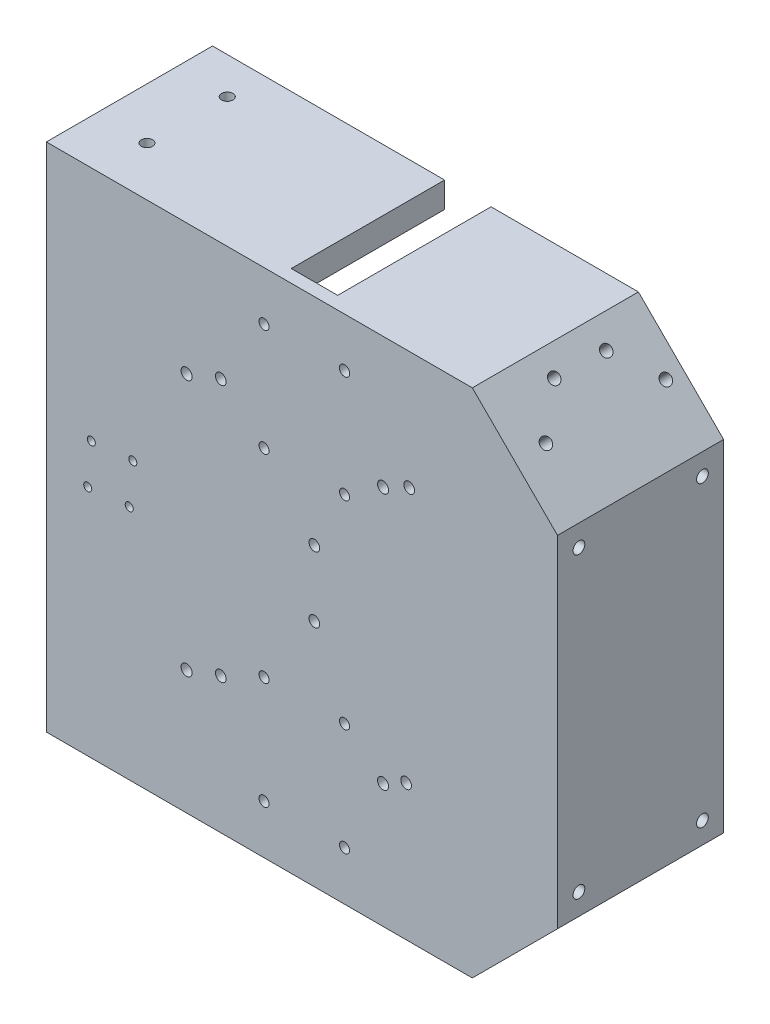
from build123d import *

# Parameters (mm, degrees)
BOSS_EXTRUDE1_DEPTH = 3.81
BOSS_EXTRUDE2_DEPTH = 45.72
SKETCH7_R           = 1.2
CUT_EXTRUDE2_DEPTH  = 17.78
SKETCH8_W           = 32.05672174
SKETCH8_H           = 17.78
SKETCH8_W_2         = 39.67672174
SKETCH8_H_2         = 25.4
BOSS_EXTRUDE3_DEPTH = 3.81
SKETCH9_R           = 1.65
CUT_EXTRUDE3_DEPTH  = 3.81
SKETCH10_R          = 1.547764227
SKETCH10_R_2        = 1.5
CUT_EXTRUDE4_DEPTH  = 7.62
CUT_EXTRUDE5_REACH  = 178.416
SKETCH11_R          = 1.7
SKETCH12_R          = 1.699999995
SKETCH12_R_2        = 1.691563864
CUT_EXTRUDE6_DEPTH  = 208.601302742
CUT_EXTRUDE7_REACH  = 208.774
SKETCH13_R          = 1.650000001
CUT_EXTRUDE8_REACH  = 208.774
SKETCH14_R          = 1.684585229
SKETCH14_R_2        = 1.65
SKETCH14_R_3        = 1.561252311
CUT_EXTRUDE9_REACH  = 163.375
SKETCH15_R          = 1.65
CUT_EXTRUDE10_REACH = 178.416
SKETCH16_R          = 1.75006
SKETCH16_R_2        = 1.750059992
CUT_EXTRUDE11_REACH = 162.247
SKETCH17_R          = 1.6
SKETCH17_R_2        = 1.599999975


with BuildPart() as part:
    # Sketch1 → Boss-Extrude1 (new body)
    with BuildSketch(Plane.XY):
        Polygon((133.35, -50.8), (107.95, -76.2), (-19.05, -76.2), (-19.05, 76.2), (107.95, 76.2), (133.35, 50.8), align=None)
    extrude(amount=BOSS_EXTRUDE1_DEPTH)

    # Sketch2 → Boss-Extrude2 (add)
    with BuildSketch(Plane(origin=(0, 0, 0), x_dir=(-1, 0, 0), z_dir=(0, 0, -1))):
        Polygon((-107.95, -76.2), (-133.35, -50.8), (-133.35, 50.8), (-107.95, 76.2), (-63.99665634, 76.2), (-63.99665634, 68.58), (-104.793692655, 68.58), (-125.73, 47.643692655), (-125.73, -47.643692655), (-104.793692655, -68.58), (-63.99665634, -68.58), (-63.99665634, -76.2), align=None)
        Polygon((19.05, 76.2), (19.05, 24.36400377), (11.43, 24.36400377), (11.43, 68.58), (-50.152826914, 68.58), (-50.152826914, 76.2), align=None)
        Polygon((19.05, -76.2), (-50.152826914, -76.2), (-50.152826914, -68.58), (11.43, -68.58), (11.43, -24.36400377), (19.05, -24.36400377), align=None)
    extrude(amount=BOSS_EXTRUDE2_DEPTH)

    # Sketch7 → Cut-Extrude2 (cut)
    with BuildSketch(Plane(origin=(0, 0, 0), x_dir=(-1, 0, 0), z_dir=(0, 0, -1))):
        with Locations((-6.717514421, 6.717514421)):
            Circle(SKETCH7_R)
        with Locations((5.65685425, 5.65685425)):
            Circle(SKETCH7_R)
        with Locations((-5.656854249, -5.656854249)):
            Circle(SKETCH7_R)
        with Locations((6.717514421, -6.717514421)):
            Circle(SKETCH7_R)
    extrude(amount=-CUT_EXTRUDE2_DEPTH, mode=Mode.SUBTRACT)

    # Sketch8 → Boss-Extrude3 (add)
    with BuildSketch(Plane(origin=(0, 0, -45.72), x_dir=(-1, 0, 0), z_dir=(0, 0, -1))):
        with Locations((-4.59836087, 59.69)):
            Rectangle(SKETCH8_W, SKETCH8_H)
        Polygon((-86.172373763, 50.8), (-85.97332817, 76.2), (-107.95, 76.2), (-133.35, 50.8), align=None)
        Polygon((-107.95, -76.2), (-133.35, -50.8), (-86.172373763, -50.8), (-85.97332817, -76.2), align=None)
        with Locations((-0.78836087, -63.5)):
            Rectangle(SKETCH8_W_2, SKETCH8_H_2)
        Polygon((19.05, 50.8), (19.05, 76.2), (-20.62672174, 76.2), (-20.62672174, 68.58), (11.43, 68.58), (11.43, 50.8), align=None)
    extrude(amount=-BOSS_EXTRUDE3_DEPTH)

    # Sketch9 → Cut-Extrude3 (cut)
    with BuildSketch(Plane(origin=(0, 0, -45.72), x_dir=(-1, 0, 0), z_dir=(0, 0, -1))):
        with Locations((-92.542171462, 57.577017073)):
            Circle(SKETCH9_R)
        with Locations((-108.82023471, 57.577017073)):
            Circle(SKETCH9_R)
        with Locations((-14.239074115, 57.577017073)):
            Circle(SKETCH9_R)
        with Locations((1.75833287, 57.577017073)):
            Circle(SKETCH9_R)
        with Locations((1.75833287, -57.577017073)):
            Circle(SKETCH9_R)
        with Locations((-14.239074115, -57.577017073)):
            Circle(SKETCH9_R)
        with Locations((-92.542171462, -57.577017073)):
            Circle(SKETCH9_R)
        with Locations((-108.82023471, -57.577017073)):
            Circle(SKETCH9_R)
    extrude(amount=-CUT_EXTRUDE3_DEPTH, mode=Mode.SUBTRACT)

    # Sketch10 → Cut-Extrude4 (cut)
    with BuildSketch(Plane(origin=(0, 0, 0), x_dir=(-1, 0, 0), z_dir=(0, 0, -1))):
        with Locations((-69.848195186, 61.58)):
            Circle(SKETCH10_R)
        with Locations((-45.848195186, 61.58)):
            Circle(SKETCH10_R_2)
        with Locations((-45.848195186, 29.58)):
            Circle(SKETCH10_R_2)
        with Locations((-69.848195186, 29.58)):
            Circle(SKETCH10_R_2)
        with Locations((-69.848195186, -29.58)):
            Circle(SKETCH10_R_2)
        with Locations((-45.848195186, -29.58)):
            Circle(SKETCH10_R_2)
        with Locations((-69.848195186, -61.58)):
            Circle(SKETCH10_R_2)
        with Locations((-45.848195186, -61.58)):
            Circle(SKETCH10_R_2)
    extrude(amount=-CUT_EXTRUDE4_DEPTH, mode=Mode.SUBTRACT)

    # Sketch11 → Cut-Extrude5 (cut, up to next)
    with BuildSketch(Plane.ZY.offset(19.05), mode=Mode.PRIVATE) as cut_extrude5_sk1:
        with Locations(Location((-32.099336029, -62.639029713, 0), (0, 0, 270))):
            Circle(SKETCH11_R)
    cut_extrude5_tool1 = extrude(cut_extrude5_sk1.sketch, amount=-CUT_EXTRUDE5_REACH, mode=Mode.PRIVATE) & part.part
    # Sketch11 → Cut-Extrude5 (cut, up to next)
    with BuildSketch(Plane.ZY.offset(19.05), mode=Mode.PRIVATE) as cut_extrude5_sk2:
        with Locations(Location((-9.810663971, -62.639029713, 0), (0, 0, 270))):
            Circle(SKETCH11_R)
    cut_extrude5_tool2 = extrude(cut_extrude5_sk2.sketch, amount=-CUT_EXTRUDE5_REACH, mode=Mode.PRIVATE) & part.part
    # Sketch11 → Cut-Extrude5 (cut, up to next)
    with BuildSketch(Plane.ZY.offset(19.05), mode=Mode.PRIVATE) as cut_extrude5_sk3:
        with Locations(Location((-9.810663971, -37.924974057, 0), (0, 0, 270))):
            Circle(SKETCH11_R)
    cut_extrude5_tool3 = extrude(cut_extrude5_sk3.sketch, amount=-CUT_EXTRUDE5_REACH, mode=Mode.PRIVATE) & part.part
    # Sketch11 → Cut-Extrude5 (cut, up to next)
    with BuildSketch(Plane.ZY.offset(19.05), mode=Mode.PRIVATE) as cut_extrude5_sk4:
        with Locations(Location((-32.099336029, -37.924974057, 0), (0, 0, 270))):
            Circle(SKETCH11_R)
    cut_extrude5_tool4 = extrude(cut_extrude5_sk4.sketch, amount=-CUT_EXTRUDE5_REACH, mode=Mode.PRIVATE) & part.part
    # Sketch11 → Cut-Extrude5 (cut, up to next)
    with BuildSketch(Plane.ZY.offset(19.05), mode=Mode.PRIVATE) as cut_extrude5_sk5:
        with Locations(Location((-9.810663971, 37.924974057, 0), (0, 0, 270))):
            Circle(SKETCH11_R)
    cut_extrude5_tool5 = extrude(cut_extrude5_sk5.sketch, amount=-CUT_EXTRUDE5_REACH, mode=Mode.PRIVATE) & part.part
    # Sketch11 → Cut-Extrude5 (cut, up to next)
    with BuildSketch(Plane.ZY.offset(19.05), mode=Mode.PRIVATE) as cut_extrude5_sk6:
        with Locations(Location((-9.810663971, 62.639029713, 0), (0, 0, 270))):
            Circle(SKETCH11_R)
    cut_extrude5_tool6 = extrude(cut_extrude5_sk6.sketch, amount=-CUT_EXTRUDE5_REACH, mode=Mode.PRIVATE) & part.part
    # Sketch11 → Cut-Extrude5 (cut, up to next)
    with BuildSketch(Plane.ZY.offset(19.05), mode=Mode.PRIVATE) as cut_extrude5_sk7:
        with Locations(Location((-32.099336029, 37.924974057, 0), (0, 0, 270))):
            Circle(SKETCH11_R)
    cut_extrude5_tool7 = extrude(cut_extrude5_sk7.sketch, amount=-CUT_EXTRUDE5_REACH, mode=Mode.PRIVATE) & part.part
    # Sketch11 → Cut-Extrude5 (cut, up to next)
    with BuildSketch(Plane.ZY.offset(19.05), mode=Mode.PRIVATE) as cut_extrude5_sk8:
        with Locations(Location((-32.099336029, 62.639029713, 0), (0, 0, 270))):
            Circle(SKETCH11_R)
    cut_extrude5_tool8 = extrude(cut_extrude5_sk8.sketch, amount=-CUT_EXTRUDE5_REACH, mode=Mode.PRIVATE) & part.part
    add(cut_extrude5_tool1.solids().sort_by_distance((-19.05, -62.63903, -32.099336))[0], mode=Mode.SUBTRACT)
    add(cut_extrude5_tool2.solids().sort_by_distance((-19.05, -62.63903, -9.810664))[0], mode=Mode.SUBTRACT)
    add(cut_extrude5_tool3.solids().sort_by_distance((-19.05, -37.924974, -9.810664))[0], mode=Mode.SUBTRACT)
    add(cut_extrude5_tool4.solids().sort_by_distance((-19.05, -37.924974, -32.099336))[0], mode=Mode.SUBTRACT)
    add(cut_extrude5_tool5.solids().sort_by_distance((-19.05, 37.924974, -9.810664))[0], mode=Mode.SUBTRACT)
    add(cut_extrude5_tool6.solids().sort_by_distance((-19.05, 62.63903, -9.810664))[0], mode=Mode.SUBTRACT)
    add(cut_extrude5_tool7.solids().sort_by_distance((-19.05, 37.924974, -32.099336))[0], mode=Mode.SUBTRACT)
    add(cut_extrude5_tool8.solids().sort_by_distance((-19.05, 62.63903, -32.099336))[0], mode=Mode.SUBTRACT)

    # Sketch12 → Cut-Extrude6 (cut, through all)
    with BuildSketch(Plane(origin=(0, 76.2, 0), x_dir=(1, 0, 0), z_dir=(0, 1, 0))):
        with Locations(Location((-3.759933997, 34.826686814, 0), (0, 0, 180))):
            Circle(SKETCH12_R)
        with Locations(Location((-3.759933997, 10.893313186, 0), (0, 0, 180))):
            Circle(SKETCH12_R_2)
    extrude(amount=-CUT_EXTRUDE6_DEPTH, mode=Mode.SUBTRACT)

    # Sketch13 → Cut-Extrude7 (cut, up to next)
    with BuildSketch(Plane(origin=(92.075, 92.075, 0), x_dir=(0, 0, -1), z_dir=(0.7071067811865476, 0.7071067811865476, 0)), mode=Mode.PRIVATE) as cut_extrude7_sk1:
        with Locations(Location((30.939154806, -29.801242629, 0), (0, 0, 90))):
            Circle(SKETCH13_R)
    cut_extrude7_tool1 = extrude(cut_extrude7_sk1.sketch, amount=-CUT_EXTRUDE7_REACH, mode=Mode.PRIVATE) & part.part
    # Sketch13 → Cut-Extrude7 (cut, up to next)
    with BuildSketch(Plane(origin=(92.075, 92.075, 0), x_dir=(0, 0, -1), z_dir=(0.7071067811865476, 0.7071067811865476, 0)), mode=Mode.PRIVATE) as cut_extrude7_sk2:
        with Locations(Location((40.531445637, -41.34125457, 0), (0, 0, 90))):
            Circle(SKETCH13_R)
    cut_extrude7_tool2 = extrude(cut_extrude7_sk2.sketch, amount=-CUT_EXTRUDE7_REACH, mode=Mode.PRIVATE) & part.part
    # Sketch13 → Cut-Extrude7 (cut, up to next)
    with BuildSketch(Plane(origin=(92.075, 92.075, 0), x_dir=(0, 0, -1), z_dir=(0.7071067811865476, 0.7071067811865476, 0)), mode=Mode.PRIVATE) as cut_extrude7_sk3:
        with Locations(Location((5.495383695, -40.327271008, 0), (0, 0, 90))):
            Circle(SKETCH13_R)
    cut_extrude7_tool3 = extrude(cut_extrude7_sk3.sketch, amount=-CUT_EXTRUDE7_REACH, mode=Mode.PRIVATE) & part.part
    # Sketch13 → Cut-Extrude7 (cut, up to next)
    with BuildSketch(Plane(origin=(92.075, 92.075, 0), x_dir=(0, 0, -1), z_dir=(0.7071067811865476, 0.7071067811865476, 0)), mode=Mode.PRIVATE) as cut_extrude7_sk4:
        with Locations(Location((15.739022353, -29.361333473, 0), (0, 0, 90))):
            Circle(SKETCH13_R)
    cut_extrude7_tool4 = extrude(cut_extrude7_sk4.sketch, amount=-CUT_EXTRUDE7_REACH, mode=Mode.PRIVATE) & part.part
    add(cut_extrude7_tool1.solids().sort_by_distance((113.147661, 71.002339, -30.939155))[0], mode=Mode.SUBTRACT)
    add(cut_extrude7_tool2.solids().sort_by_distance((121.307681, 62.842319, -40.531446))[0], mode=Mode.SUBTRACT)
    add(cut_extrude7_tool3.solids().sort_by_distance((120.590687, 63.559313, -5.495384))[0], mode=Mode.SUBTRACT)
    add(cut_extrude7_tool4.solids().sort_by_distance((112.836598, 71.313402, -15.739022))[0], mode=Mode.SUBTRACT)

    # Sketch14 → Cut-Extrude8 (cut, up to next)
    with BuildSketch(Plane(origin=(92.075, -92.075, 0), x_dir=(0, 0, -1), z_dir=(0.7071067811865468, -0.7071067811865482, 0)), mode=Mode.PRIVATE) as cut_extrude8_sk1:
        with Locations(Location((40.224616305, 40.327271004, 0), (0, 0, 90))):
            Circle(SKETCH14_R)
    cut_extrude8_tool1 = extrude(cut_extrude8_sk1.sketch, amount=-CUT_EXTRUDE8_REACH, mode=Mode.PRIVATE) & part.part
    # Sketch14 → Cut-Extrude8 (cut, up to next)
    with BuildSketch(Plane(origin=(92.075, -92.075, 0), x_dir=(0, 0, -1), z_dir=(0.7071067811865468, -0.7071067811865482, 0)), mode=Mode.PRIVATE) as cut_extrude8_sk2:
        with Locations(Location((29.980977647, 29.361333469, 0), (0, 0, 90))):
            Circle(SKETCH14_R_2)
    cut_extrude8_tool2 = extrude(cut_extrude8_sk2.sketch, amount=-CUT_EXTRUDE8_REACH, mode=Mode.PRIVATE) & part.part
    # Sketch14 → Cut-Extrude8 (cut, up to next)
    with BuildSketch(Plane(origin=(92.075, -92.075, 0), x_dir=(0, 0, -1), z_dir=(0.7071067811865468, -0.7071067811865482, 0)), mode=Mode.PRIVATE) as cut_extrude8_sk3:
        with Locations(Location((14.780845194, 29.801242626, 0), (0, 0, 90))):
            Circle(SKETCH14_R_3)
    cut_extrude8_tool3 = extrude(cut_extrude8_sk3.sketch, amount=-CUT_EXTRUDE8_REACH, mode=Mode.PRIVATE) & part.part
    # Sketch14 → Cut-Extrude8 (cut, up to next)
    with BuildSketch(Plane(origin=(92.075, -92.075, 0), x_dir=(0, 0, -1), z_dir=(0.7071067811865468, -0.7071067811865482, 0)), mode=Mode.PRIVATE) as cut_extrude8_sk4:
        with Locations(Location((5.188554363, 41.341254567, 0), (0, 0, 90))):
            Circle(SKETCH14_R_2)
    cut_extrude8_tool4 = extrude(cut_extrude8_sk4.sketch, amount=-CUT_EXTRUDE8_REACH, mode=Mode.PRIVATE) & part.part
    add(cut_extrude8_tool1.solids().sort_by_distance((120.590687, -63.559313, -40.224616))[0], mode=Mode.SUBTRACT)
    add(cut_extrude8_tool2.solids().sort_by_distance((112.836598, -71.313402, -29.980978))[0], mode=Mode.SUBTRACT)
    add(cut_extrude8_tool3.solids().sort_by_distance((113.147661, -71.002339, -14.780845))[0], mode=Mode.SUBTRACT)
    add(cut_extrude8_tool4.solids().sort_by_distance((121.307681, -62.842319, -5.188554))[0], mode=Mode.SUBTRACT)

    # Sketch15 → Cut-Extrude9 (cut, up to next)
    with BuildSketch(Plane.XY.offset(3.81), mode=Mode.PRIVATE) as cut_extrude9_sk1:
        with Locations((81.342772659, -39.263761481)):
            Circle(SKETCH15_R)
    cut_extrude9_tool1 = extrude(cut_extrude9_sk1.sketch, amount=-CUT_EXTRUDE9_REACH, mode=Mode.PRIVATE) & part.part
    # Sketch15 → Cut-Extrude9 (cut, up to next)
    with BuildSketch(Plane.XY.offset(3.81), mode=Mode.PRIVATE) as cut_extrude9_sk2:
        with Locations((22.748429848, -39.263761481)):
            Circle(SKETCH15_R)
    cut_extrude9_tool2 = extrude(cut_extrude9_sk2.sketch, amount=-CUT_EXTRUDE9_REACH, mode=Mode.PRIVATE) & part.part
    # Sketch15 → Cut-Extrude9 (cut, up to next)
    with BuildSketch(Plane.XY.offset(3.81), mode=Mode.PRIVATE) as cut_extrude9_sk3:
        with Locations((81.342772659, 37.237081194)):
            Circle(SKETCH15_R)
    cut_extrude9_tool3 = extrude(cut_extrude9_sk3.sketch, amount=-CUT_EXTRUDE9_REACH, mode=Mode.PRIVATE) & part.part
    # Sketch15 → Cut-Extrude9 (cut, up to next)
    with BuildSketch(Plane.XY.offset(3.81), mode=Mode.PRIVATE) as cut_extrude9_sk4:
        with Locations((22.748429848, 37.237081194)):
            Circle(SKETCH15_R)
    cut_extrude9_tool4 = extrude(cut_extrude9_sk4.sketch, amount=-CUT_EXTRUDE9_REACH, mode=Mode.PRIVATE) & part.part
    add(cut_extrude9_tool1.solids().sort_by_distance((81.342773, -39.263761, 3.81))[0], mode=Mode.SUBTRACT)
    add(cut_extrude9_tool2.solids().sort_by_distance((22.74843, -39.263761, 3.81))[0], mode=Mode.SUBTRACT)
    add(cut_extrude9_tool3.solids().sort_by_distance((81.342773, 37.237081, 3.81))[0], mode=Mode.SUBTRACT)
    add(cut_extrude9_tool4.solids().sort_by_distance((22.74843, 37.237081, 3.81))[0], mode=Mode.SUBTRACT)

    # Sketch16 → Cut-Extrude10 (cut, up to next)
    with BuildSketch(Plane(origin=(133.35, 0, 0), x_dir=(0, 0, -1), z_dir=(1, 0, 0)), mode=Mode.PRIVATE) as cut_extrude10_sk1:
        with Locations(Location((39.407709478, 44.45, 0), (0, 0, 90))):
            Circle(SKETCH16_R)
    cut_extrude10_tool1 = extrude(cut_extrude10_sk1.sketch, amount=-CUT_EXTRUDE10_REACH, mode=Mode.PRIVATE) & part.part
    # Sketch16 → Cut-Extrude10 (cut, up to next)
    with BuildSketch(Plane(origin=(133.35, 0, 0), x_dir=(0, 0, -1), z_dir=(1, 0, 0)), mode=Mode.PRIVATE) as cut_extrude10_sk2:
        with Locations(Location((2.577709478, 44.45, 0), (0, 0, 90))):
            Circle(SKETCH16_R)
    cut_extrude10_tool2 = extrude(cut_extrude10_sk2.sketch, amount=-CUT_EXTRUDE10_REACH, mode=Mode.PRIVATE) & part.part
    # Sketch16 → Cut-Extrude10 (cut, up to next)
    with BuildSketch(Plane(origin=(133.35, 0, 0), x_dir=(0, 0, -1), z_dir=(1, 0, 0)), mode=Mode.PRIVATE) as cut_extrude10_sk3:
        with Locations(Location((39.407709478, -44.45, 0), (0, 0, 90))):
            Circle(SKETCH16_R_2)
    cut_extrude10_tool3 = extrude(cut_extrude10_sk3.sketch, amount=-CUT_EXTRUDE10_REACH, mode=Mode.PRIVATE) & part.part
    # Sketch16 → Cut-Extrude10 (cut, up to next)
    with BuildSketch(Plane(origin=(133.35, 0, 0), x_dir=(0, 0, -1), z_dir=(1, 0, 0)), mode=Mode.PRIVATE) as cut_extrude10_sk4:
        with Locations(Location((2.577709478, -44.45, 0), (0, 0, 90))):
            Circle(SKETCH16_R)
    cut_extrude10_tool4 = extrude(cut_extrude10_sk4.sketch, amount=-CUT_EXTRUDE10_REACH, mode=Mode.PRIVATE) & part.part
    add(cut_extrude10_tool1.solids().sort_by_distance((133.35, 44.45, -39.407709))[0], mode=Mode.SUBTRACT)
    add(cut_extrude10_tool2.solids().sort_by_distance((133.35, 44.45, -2.577709))[0], mode=Mode.SUBTRACT)
    add(cut_extrude10_tool3.solids().sort_by_distance((133.35, -44.45, -39.407709))[0], mode=Mode.SUBTRACT)
    add(cut_extrude10_tool4.solids().sort_by_distance((133.35, -44.45, -2.577709))[0], mode=Mode.SUBTRACT)

    # Sketch17 → Cut-Extrude11 (cut, up to next)
    with BuildSketch(Plane(origin=(0, 0, 0), x_dir=(-1, 0, 0), z_dir=(0, 0, -1)), mode=Mode.PRIVATE) as cut_extrude11_sk1:
        with Locations((-89.135691587, 41.019672651)):
            Circle(SKETCH17_R)
    cut_extrude11_tool1 = extrude(cut_extrude11_sk1.sketch, amount=-CUT_EXTRUDE11_REACH, mode=Mode.PRIVATE) & part.part
    # Sketch17 → Cut-Extrude11 (cut, up to next)
    with BuildSketch(Plane(origin=(0, 0, 0), x_dir=(-1, 0, 0), z_dir=(0, 0, -1)), mode=Mode.PRIVATE) as cut_extrude11_sk2:
        with Locations((-32.954133945, 41.019672651)):
            Circle(SKETCH17_R_2)
    cut_extrude11_tool2 = extrude(cut_extrude11_sk2.sketch, amount=-CUT_EXTRUDE11_REACH, mode=Mode.PRIVATE) & part.part
    # Sketch17 → Cut-Extrude11 (cut, up to next)
    with BuildSketch(Plane(origin=(0, 0, 0), x_dir=(-1, 0, 0), z_dir=(0, 0, -1)), mode=Mode.PRIVATE) as cut_extrude11_sk3:
        with Locations((-60.849662348, 11.984663425)):
            Circle(SKETCH17_R)
    cut_extrude11_tool3 = extrude(cut_extrude11_sk3.sketch, amount=-CUT_EXTRUDE11_REACH, mode=Mode.PRIVATE) & part.part
    # Sketch17 → Cut-Extrude11 (cut, up to next)
    with BuildSketch(Plane(origin=(0, 0, 0), x_dir=(-1, 0, 0), z_dir=(0, 0, -1)), mode=Mode.PRIVATE) as cut_extrude11_sk4:
        with Locations((-60.849662348, -7.645160574)):
            Circle(SKETCH17_R_2)
    cut_extrude11_tool4 = extrude(cut_extrude11_sk4.sketch, amount=-CUT_EXTRUDE11_REACH, mode=Mode.PRIVATE) & part.part
    # Sketch17 → Cut-Extrude11 (cut, up to next)
    with BuildSketch(Plane(origin=(0, 0, 0), x_dir=(-1, 0, 0), z_dir=(0, 0, -1)), mode=Mode.PRIVATE) as cut_extrude11_sk5:
        with Locations((-32.954133945, -35.676004446)):
            Circle(SKETCH17_R_2)
    cut_extrude11_tool5 = extrude(cut_extrude11_sk5.sketch, amount=-CUT_EXTRUDE11_REACH, mode=Mode.PRIVATE) & part.part
    # Sketch17 → Cut-Extrude11 (cut, up to next)
    with BuildSketch(Plane(origin=(0, 0, 0), x_dir=(-1, 0, 0), z_dir=(0, 0, -1)), mode=Mode.PRIVATE) as cut_extrude11_sk6:
        with Locations((-88.211720827, -35.676004446)):
            Circle(SKETCH17_R_2)
    cut_extrude11_tool6 = extrude(cut_extrude11_sk6.sketch, amount=-CUT_EXTRUDE11_REACH, mode=Mode.PRIVATE) & part.part
    add(cut_extrude11_tool1.solids().sort_by_distance((89.135692, 41.019673, 0))[0], mode=Mode.SUBTRACT)
    add(cut_extrude11_tool2.solids().sort_by_distance((32.954134, 41.019673, 0))[0], mode=Mode.SUBTRACT)
    add(cut_extrude11_tool3.solids().sort_by_distance((60.849662, 11.984663, 0))[0], mode=Mode.SUBTRACT)
    add(cut_extrude11_tool4.solids().sort_by_distance((60.849662, -7.645161, 0))[0], mode=Mode.SUBTRACT)
    add(cut_extrude11_tool5.solids().sort_by_distance((32.954134, -35.676004, 0))[0], mode=Mode.SUBTRACT)
    add(cut_extrude11_tool6.solids().sort_by_distance((88.211721, -35.676004, 0))[0], mode=Mode.SUBTRACT)


solid = part.part
